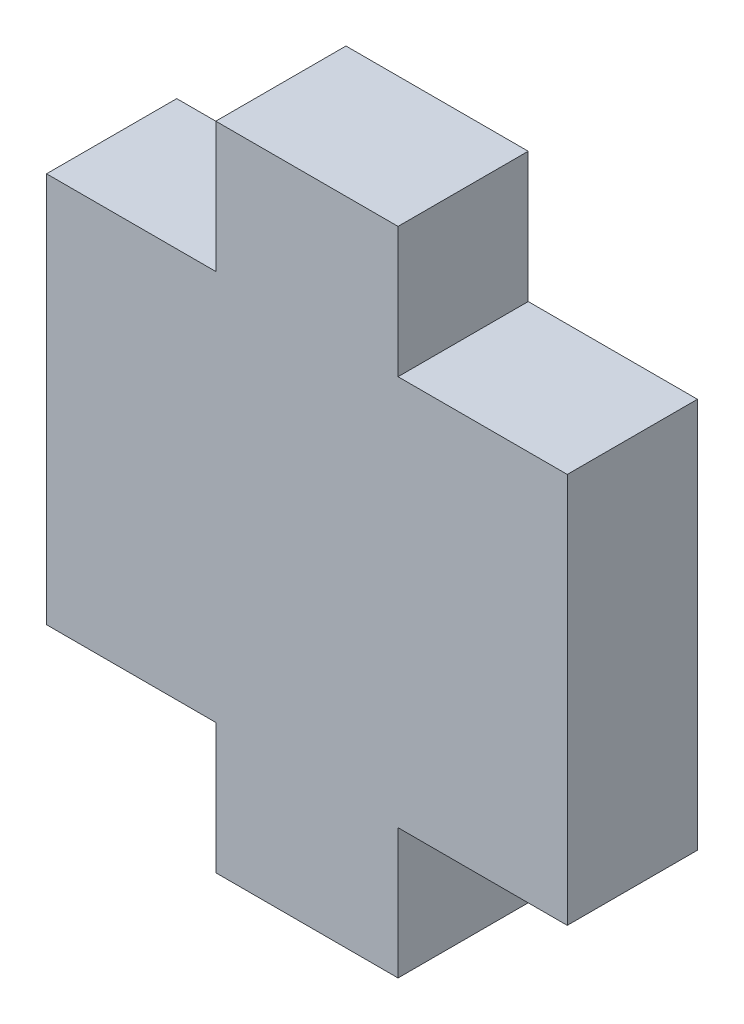
from build123d import *

# Parameters (mm, degrees)
BOSS_EXTRUDE1_DEPTH = 5


with BuildPart() as part:
    # Sketch1 → Boss-Extrude1 (new body)
    with BuildSketch(Plane.XY):
        Polygon((-10, -7.5), (-10, 7.5), (-3.5, 7.5), (-3.5, 12.5), (3.5, 12.5), (3.5, 7.5), (10, 7.5), (10, -7.5), (3.5, -7.5), (3.5, -12.5), (-3.5, -12.5), (-3.5, -7.5), align=None)
    extrude(amount=BOSS_EXTRUDE1_DEPTH)


solid = part.part
